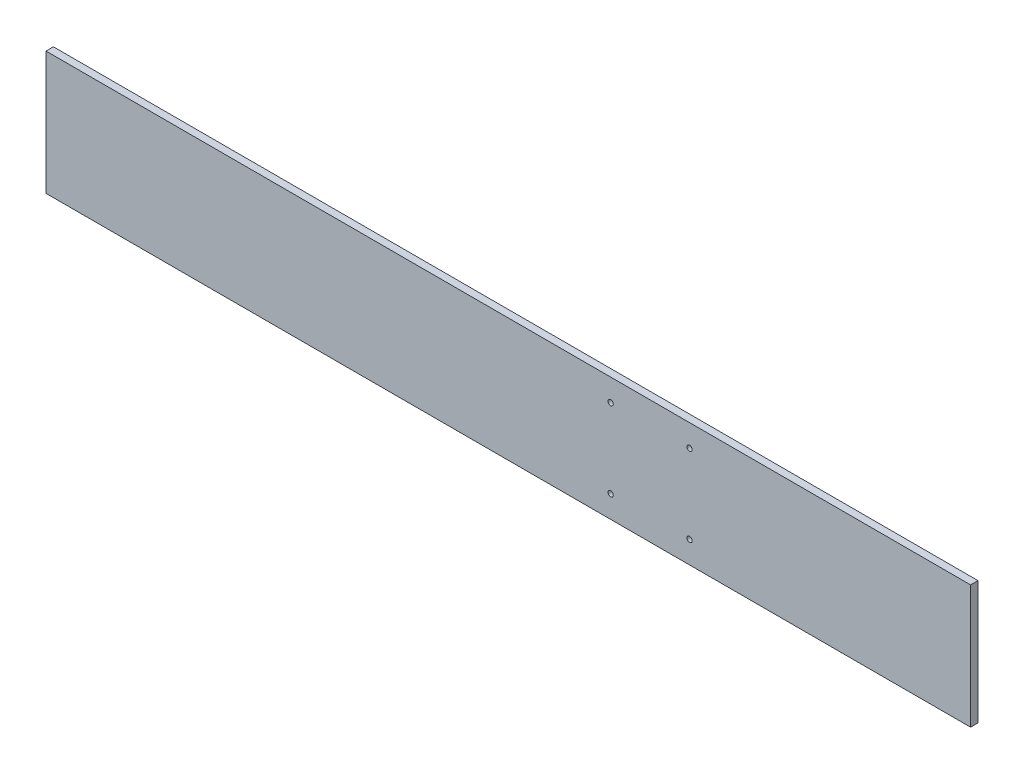
from build123d import *

# Parameters (mm, degrees)
ESQUISSE1_W                     = 750
ESQUISSE1_H                     = 100
BOSS_EXTRU_1_DEPTH              = 6
D_GAGEMENT_M43_D                = 4.3
R_P_TITION_LIN_AIRE1_COUNT      = 2
R_P_TITION_LIN_AIRE1_PITCH      = 64
R_P_TITION_LIN_AIRE1_COUNT_DIR2 = 2
R_P_TITION_LIN_AIRE1_PITCH_DIR2 = 64


with BuildPart() as part:
    # Esquisse1 → Boss.-Extru.1 (new body)
    with BuildSketch(Plane.XY):
        Rectangle(ESQUISSE1_W, ESQUISSE1_H)
    extrude(amount=BOSS_EXTRU_1_DEPTH)

    # Dégagement M43 (through all)
    with Locations(Plane(origin=(111.028323747, 8.062718608, -3), x_dir=(-1, 0, 0), z_dir=(0, 0, -1))):
        with Locations((28.028323747, -40.06271861)):
            d_gagement_m43 = Hole(D_GAGEMENT_M43_D / 2)

    # Répétition linéaire1: D_gagement M43 2 × 2
    with Locations(*[(i * R_P_TITION_LIN_AIRE1_PITCH, j * R_P_TITION_LIN_AIRE1_PITCH_DIR2, 0) for i in range(R_P_TITION_LIN_AIRE1_COUNT) for j in range(R_P_TITION_LIN_AIRE1_COUNT_DIR2) if (i, j) != (0, 0)]):
        add(d_gagement_m43, mode=Mode.SUBTRACT)


solid = part.part
